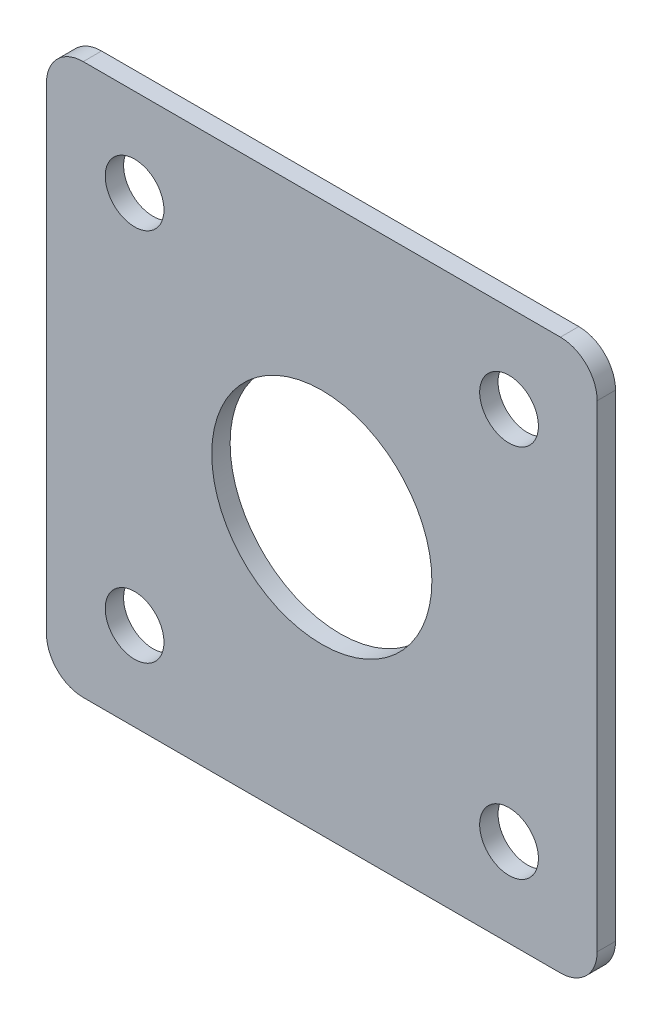
from build123d import *

# Parameters (mm, degrees)
SKETCH1_W           = 150
SKETCH1_H           = 150
SKETCH1_R           = 29.98
SKETCH1_R_2         = 8
BOSS_EXTRUDE1_DEPTH = 5
FILLET1_R           = 10


with BuildPart() as part:
    # Sketch1 → Boss-Extrude1 (new body)
    with BuildSketch(Plane.XY):
        Rectangle(SKETCH1_W, SKETCH1_H)
        Circle(SKETCH1_R, mode=Mode.SUBTRACT)
        with Locations((51, 51)):
            Circle(SKETCH1_R_2, mode=Mode.SUBTRACT)
        with Locations((-51, 51)):
            Circle(SKETCH1_R_2, mode=Mode.SUBTRACT)
        with Locations((-51, -51)):
            Circle(SKETCH1_R_2, mode=Mode.SUBTRACT)
        with Locations((51, -51)):
            Circle(SKETCH1_R_2, mode=Mode.SUBTRACT)
    extrude(amount=BOSS_EXTRUDE1_DEPTH)

    # Fillet1
    fillet1_edges = [part.edges().sort_by_distance(p)[0] for p in [
        (-75, 75, 2.5),
        (75, 75, 2.5),
        (75, -75, 2.5),
        (-75, -75, 2.5),
    ]]
    fillet(fillet1_edges, radius=FILLET1_R)


solid = part.part
